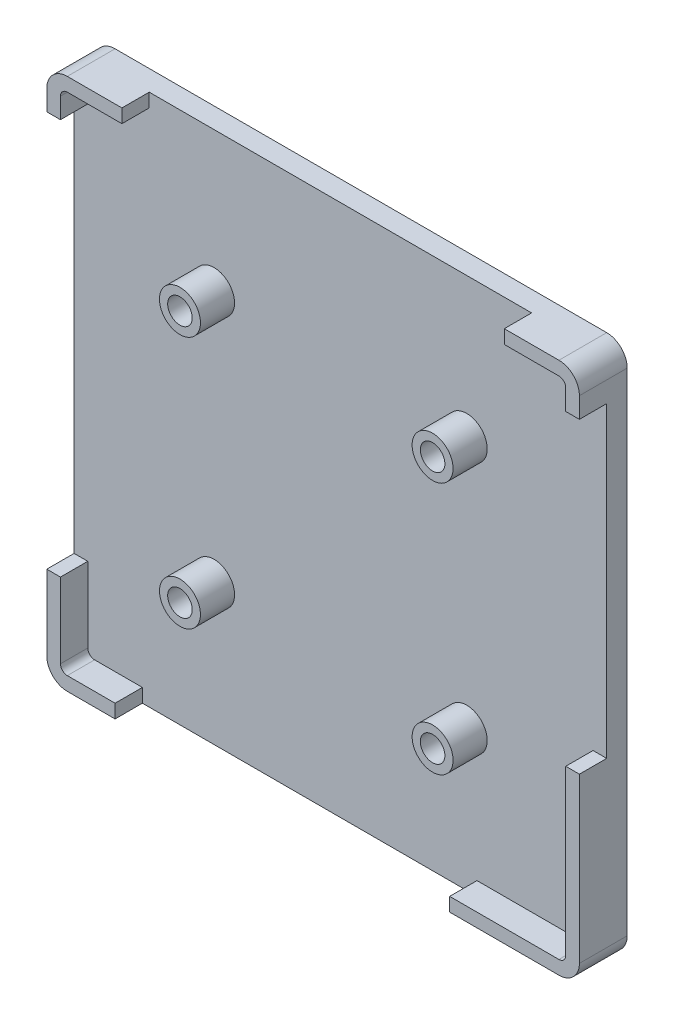
from build123d import *

# Parameters (mm, degrees)
EXTRUDE_7_DEPTH       = 7
CUT_EXTRUDE_START     = 3
CUT_EXTRUDE_3_2_DEPTH = 4
M3_M4_5V_START        = 3
SKETCH_3_W            = 6
SKETCH_3_H            = 58
M3_M4_5V_DEPTH        = 4
M2_M1_START           = 3
SKETCH_4_W            = 6
SKETCH_4_H            = 45
M2_M1_DEPTH           = 4
SKETCH_5_W            = 56
SKETCH_5_H            = 6
CUT_EXTRUDE_M3_DEPTH  = 4
DC_START              = 3
SKETCH_6_W            = 49
SKETCH_6_H            = 6
DC_DEPTH              = 4
EXTRUDE_START         = 3
SKETCH_7_R            = 3
EXTRUDE_5_DEPTH       = 5
SKETCH_8_R            = 1.8
PCB_0_3_DEPTH         = 8


with BuildPart() as part:
    # 草图1 → 底托基础_总边高7 (new body)
    with BuildSketch(Plane.XY):
        with BuildLine():
            Line((-36, -39), (36, -39))
            ThreePointArc((36, -39), (38.121320344, -38.121320344), (39, -36))
            Line((39, -36), (39, 36))
            ThreePointArc((39, 36), (38.121320344, 38.121320344), (36, 39))
            Line((36, 39), (-36, 39))
            ThreePointArc((-36, 39), (-38.121320344, 38.121320344), (-39, 36))
            Line((-39, 36), (-39, -36))
            ThreePointArc((-39, -36), (-38.121320344, -38.121320344), (-36, -39))
        make_face()
    extrude(amount=EXTRUDE_7_DEPTH)

    # 草图2 → 底腔_实体绝缘底厚3_侧壁2 (cut)
    with BuildSketch(Plane.XY.offset(CUT_EXTRUDE_START)):
        with BuildLine():
            Line((-36, -37), (36, -37))
            ThreePointArc((36, -37), (36.707106781, -36.707106781), (37, -36))
            Line((37, -36), (37, 36))
            ThreePointArc((37, 36), (36.707106781, 36.707106781), (36, 37))
            Line((36, 37), (-36, 37))
            ThreePointArc((-36, 37), (-36.707106781, 36.707106781), (-37, 36))
            Line((-37, 36), (-37, -36))
            ThreePointArc((-37, -36), (-36.707106781, -36.707106781), (-36, -37))
        make_face()
    extrude(amount=CUT_EXTRUDE_3_2_DEPTH, mode=Mode.SUBTRACT)

    # 草图3 → 左侧M3_M4编码器及5V接口开口_不切穿绝缘底板 (cut)
    with BuildSketch(Plane.XY.offset(M3_M4_5V_START)):
        with Locations((-39, 4)):
            Rectangle(SKETCH_3_W, SKETCH_3_H)
    extrude(amount=M3_M4_5V_DEPTH, mode=Mode.SUBTRACT)

    # 草图4 → 右侧M2_M1及电机接口开口_不切穿绝缘底板 (cut)
    with BuildSketch(Plane.XY.offset(M2_M1_START)):
        with Locations((39, 10.5)):
            Rectangle(SKETCH_4_W, SKETCH_4_H)
    extrude(amount=M2_M1_DEPTH, mode=Mode.SUBTRACT)

    # 草图5 → 上侧控制与编码器及M3接口开口_不切穿绝缘底板 (cut)
    with BuildSketch(Plane.XY.offset(CUT_EXTRUDE_START)):
        with Locations((0, 39)):
            Rectangle(SKETCH_5_W, SKETCH_5_H)
    extrude(amount=CUT_EXTRUDE_M3_DEPTH, mode=Mode.SUBTRACT)

    # 草图6 → 下侧凤凰端子_DC_电源开关共用开口_不切穿绝缘底板 (cut)
    with BuildSketch(Plane.XY.offset(DC_START)):
        with Locations((-4.5, -39)):
            Rectangle(SKETCH_6_W, SKETCH_6_H)
    extrude(amount=DC_DEPTH, mode=Mode.SUBTRACT)

    # 草图7 → 四根绝缘支柱_板背净距5 (add)
    with BuildSketch(Plane.XY.offset(EXTRUDE_START)):
        with Locations((-18.5, -18.5)):
            Circle(SKETCH_7_R)
        with Locations((-18.5, 18.5)):
            Circle(SKETCH_7_R)
        with Locations((18.5, -18.5)):
            Circle(SKETCH_7_R)
        with Locations((18.5, 18.5)):
            Circle(SKETCH_7_R)
    extrude(amount=EXTRUDE_5_DEPTH)

    # 草图8 → PCB与底部对齐通孔_单边0.3 (cut)
    with BuildSketch(Plane.XY):
        with Locations((-18.5, -18.5)):
            Circle(SKETCH_8_R)
        with Locations((-18.5, 18.5)):
            Circle(SKETCH_8_R)
        with Locations((18.5, -18.5)):
            Circle(SKETCH_8_R)
        with Locations((18.5, 18.5)):
            Circle(SKETCH_8_R)
    extrude(amount=PCB_0_3_DEPTH, mode=Mode.SUBTRACT)


solid = part.part
